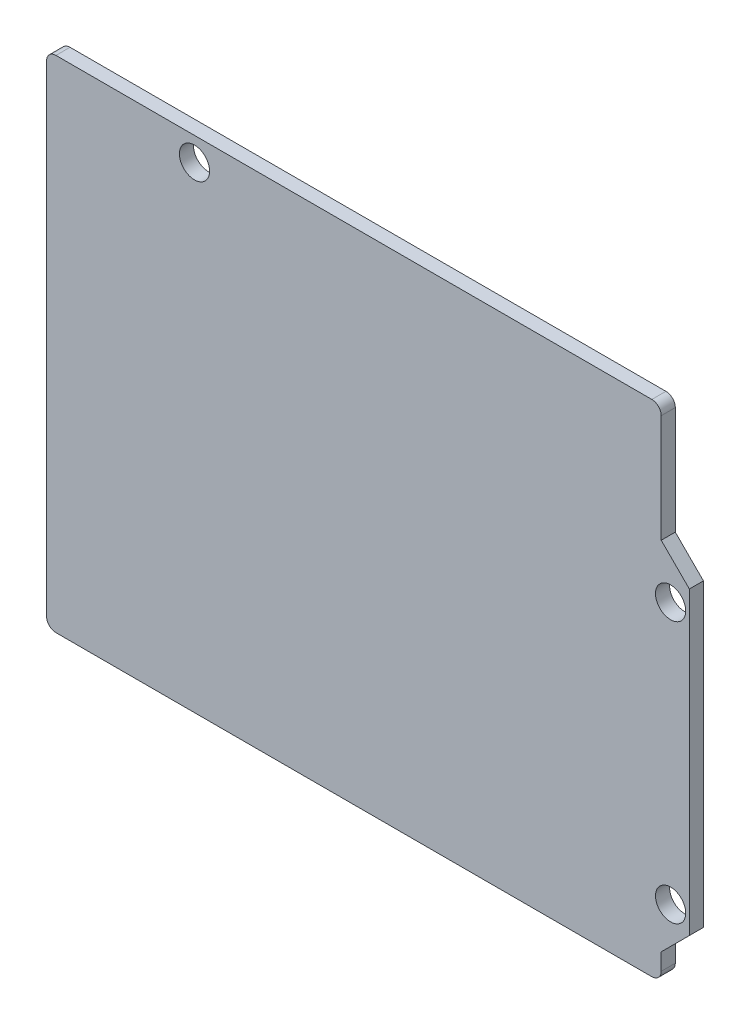
from build123d import *

# Parameters (mm, degrees)
ESQUISSE1_R        = 1.61
BOSS_EXTRU_1_DEPTH = 1.5


with BuildPart() as part:
    # Esquisse1 → Boss.-Extru.1 (new body)
    with BuildSketch(Plane.XY):
        with BuildLine():
            Line((31.265, 25.65), (31.265, 14.15))
            Line((31.265, 14.15), (34.265, 11.15))
            Line((34.265, 11.15), (34.265, -20.85))
            Line((34.265, -20.85), (31.265, -23.85))
            Line((31.265, -23.85), (31.265, -25.65))
            ThreePointArc((31.265, -25.65), (30.972106781, -26.357106781), (30.265, -26.65))
            Line((30.265, -26.65), (-33.265, -26.65))
            ThreePointArc((-33.265, -26.65), (-33.972106781, -26.357106781), (-34.265, -25.65))
            Line((-34.265, -25.65), (-34.265, 25.65))
            ThreePointArc((-34.265, 25.65), (-33.972106781, 26.357106781), (-33.265, 26.65))
            Line((-33.265, 26.65), (30.265, 26.65))
            ThreePointArc((30.265, 26.65), (30.972106781, 26.357106781), (31.265, 25.65))
        make_face()
        with Locations((32.265, 8.92)):
            Circle(ESQUISSE1_R, mode=Mode.SUBTRACT)
        with Locations((32.265, -18.98)):
            Circle(ESQUISSE1_R, mode=Mode.SUBTRACT)
        with Locations((-18.495, 24.15)):
            Circle(ESQUISSE1_R, mode=Mode.SUBTRACT)
    extrude(amount=BOSS_EXTRU_1_DEPTH)


solid = part.part
